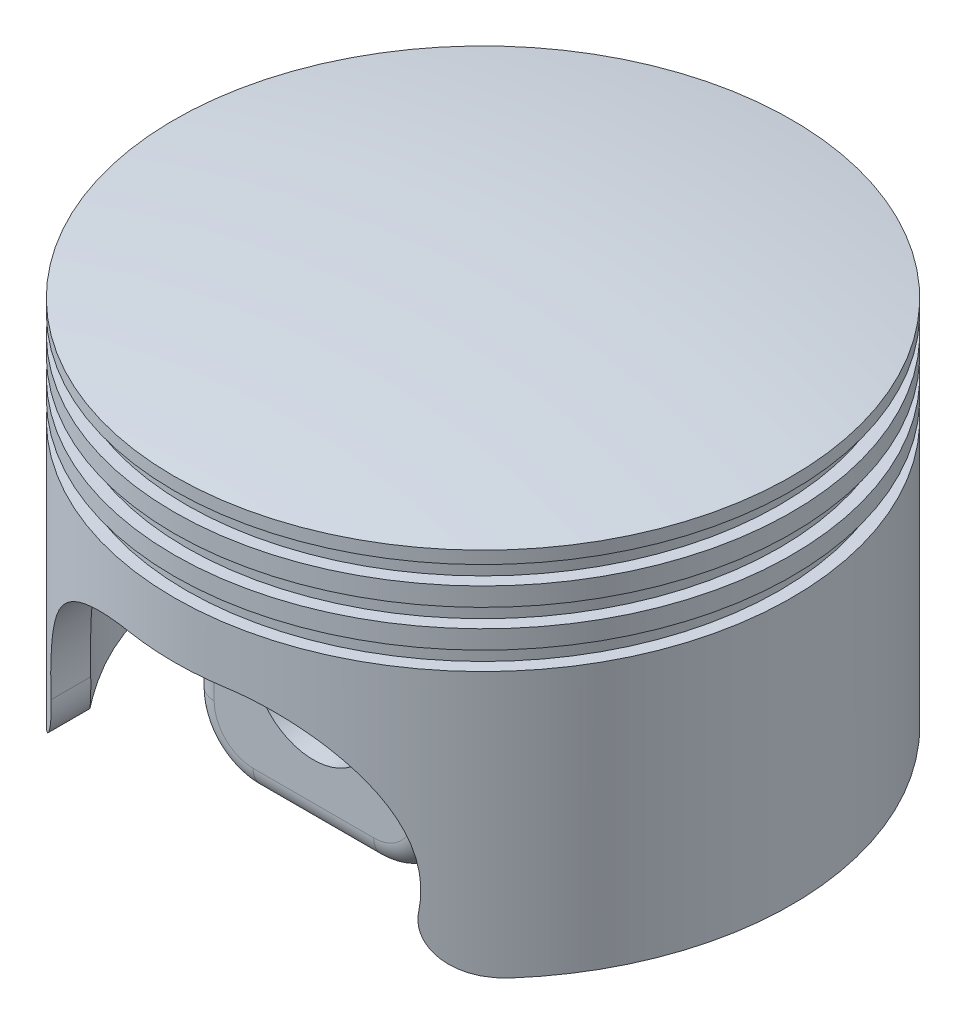
from build123d import *

# Parameters (mm, degrees)
CUT_EXTRUDE1_DEPTH      = 122.12364939
CUT_EXTRUDE1_DEPTH_BACK = 122.12364939
SKETCH3_W               = 50.8
SKETCH3_H               = 19
BOSS_EXTRUDE1_DEPTH     = 63.5
FILLET4_R               = 13
FILLET5_R               = 5
CUT_EXTRUDE3_DEPTH      = 143.538811727
CUT_EXTRUDE3_DEPTH_BACK = 143.538811727
SKETCH5_R               = 12.7


with BuildPart() as part:
    # Sketch1 → Revolve2 (revolve)
    with BuildSketch(Plane(origin=(0, 0, 0), x_dir=(0, 0, -1), z_dir=(1, 0, 0)), mode=Mode.PRIVATE) as revolve2_sk:
        with BuildLine():
            Line((63.5, 0), (63.5, 54.66))
            Line((63.5, 54.66), (60.96, 54.66))
            Line((60.96, 54.66), (60.96, 58.47))
            Line((60.96, 58.47), (63.5, 58.47))
            Line((63.5, 58.47), (63.5, 62.28))
            Line((63.5, 62.28), (60.96, 62.28))
            Line((60.96, 62.28), (60.96, 66.09))
            Line((60.96, 66.09), (63.5, 66.09))
            Line((63.5, 66.09), (63.5, 69.9))
            Line((63.5, 69.9), (60.96, 69.9))
            Line((60.96, 69.9), (60.96, 73.71))
            Line((60.96, 73.71), (63.5, 73.71))
            Line((63.5, 73.71), (63.5, 76.28))
            ThreePointArc((63.5, 76.28), (31.848271894, 80.028053051), (0, 81.28))
            Line((0, 81.28), (0, 76.28))
            Line((0, 76.28), (0, 62.28))
            Line((0, 62.28), (57.15, 62.28))
            Line((57.15, 62.28), (57.15, 0))
            Line((57.15, 0), (63.5, 0))
        make_face()
    revolve(revolve2_sk.sketch.rotate(Axis((0, 0, 0), (0, -1, 0)), 180), axis=Axis((0, 0, 0), (0, -1, 0)))

    # Sketch2 → Cut-Extrude1 (cut, two sides: drawn at the far end of the back side and taken through both)
    with BuildSketch(Plane.XY.offset(-CUT_EXTRUDE1_DEPTH_BACK)):
        with BuildLine():
            Line((0, 43.18), (-10.06, 43.18))
            ThreePointArc((-10.06, 43.18), (-31.165349783, 33.580114416), (-37.7986322, 11.363157895))
            ThreePointArc((-37.7986322, 11.363157895), (-40.167661635, 3.428530566), (-47.705286558, 0))
            Line((-47.705286558, 0), (0, 0))
            Line((0, 0), (0, 43.18))
        make_face()
        with BuildLine():
            Line((10.06, 43.18), (0, 43.18))
            Line((0, 43.18), (0, 0))
            Line((0, 0), (47.705286558, 0))
            ThreePointArc((47.705286558, 0), (40.167661635, 3.428530566), (37.7986322, 11.363157895))
            ThreePointArc((37.7986322, 11.363157895), (31.165349783, 33.580114416), (10.06, 43.18))
        make_face()
    extrude(amount=CUT_EXTRUDE1_DEPTH + CUT_EXTRUDE1_DEPTH_BACK, mode=Mode.SUBTRACT)

    # Sketch3 → Boss-Extrude1 (add)
    with BuildSketch(Plane.XZ.offset(-62.28)):
        with Locations((0, -25.38)):
            Rectangle(SKETCH3_W, SKETCH3_H)
        with Locations((0, 25.38)):
            Rectangle(SKETCH3_W, SKETCH3_H)
    extrude(amount=BOSS_EXTRUDE1_DEPTH)

    # Fillet4
    fillet4_edges = [part.edges().sort_by_distance(p)[0] for p in [
        (-25.4, -1.22, 25.38),
        (25.4, -1.22, 25.38),
        (25.4, -1.22, -25.38),
        (-25.4, -1.22, -25.38),
    ]]
    fillet(fillet4_edges, radius=FILLET4_R)

    # Fillet5
    fillet5_edges = [part.edges().sort_by_distance(p)[0] for p in [
        (0, -1.22, -34.88),
        (0, -1.22, -15.88),
        (25.4, 37.03, -34.88),
        (-25.4, 37.03, -34.88),
        (21.592388155, 2.587611845, -34.88),
        (-21.592388155, 2.587611845, -34.88),
        (-25.4, 37.03, -15.88),
        (25.4, 37.03, -15.88),
        (21.592388155, 2.587611845, -15.88),
        (-21.592388155, 2.587611845, -15.88),
        (0, -1.22, 15.88),
        (0, -1.22, 34.88),
        (25.4, 37.03, 15.88),
        (-25.4, 37.03, 15.88),
        (21.592388155, 2.587611845, 15.88),
        (-21.592388155, 2.587611845, 15.88),
        (-25.4, 37.03, 34.88),
        (25.4, 37.03, 34.88),
        (21.592388155, 2.587611845, 34.88),
        (-21.592388155, 2.587611845, 34.88),
    ]]
    fillet(fillet5_edges, radius=FILLET5_R)

    # Sketch5 → Cut-Extrude3 (cut, two sides: drawn at the far end of the back side and taken through both)
    with BuildSketch(Plane(origin=(0, 0, -34.88), x_dir=(-1, 0, 0), z_dir=(0, 0, -1)).offset(-CUT_EXTRUDE3_DEPTH_BACK)):
        with Locations(Location((0, 24.18, 0), (0, 0, 90))):
            Circle(SKETCH5_R)
    extrude(amount=CUT_EXTRUDE3_DEPTH + CUT_EXTRUDE3_DEPTH_BACK, mode=Mode.SUBTRACT)


solid = part.part
